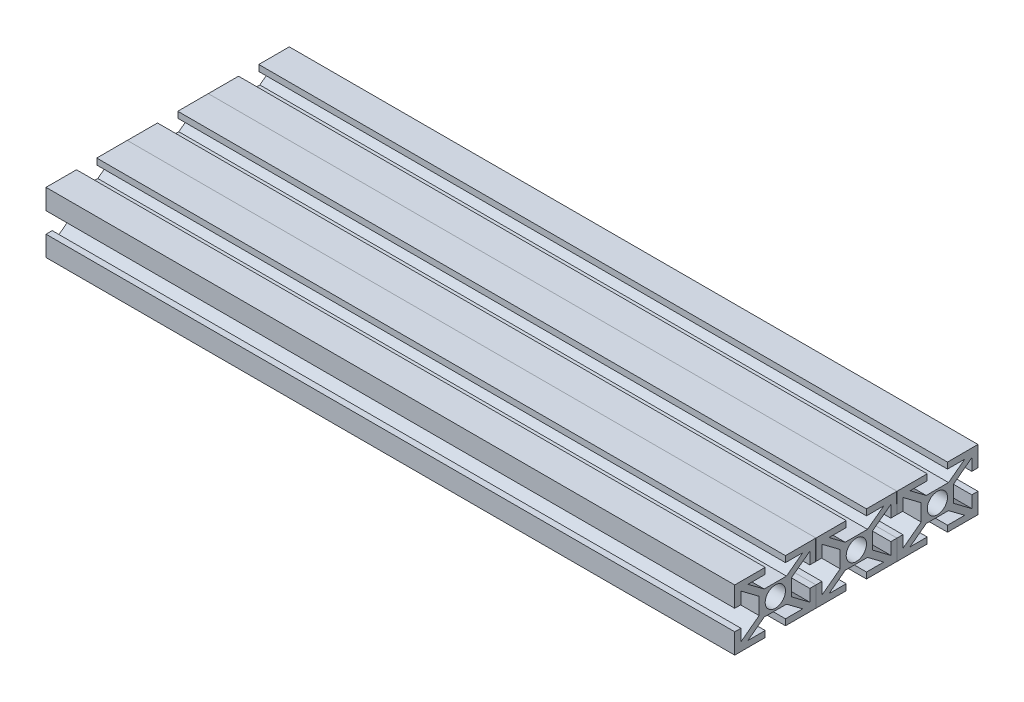
from build123d import *

# Parameters (mm, degrees)
SKETCH1_R           = 5
BOSS_EXTRUDE1_DEPTH = 340


with BuildPart() as part:
    # Sketch1 → Boss-Extrude1 (new body)
    # profile 1 of 3: a face of its own
    with BuildSketch(Plane(origin=(0, 0, 0), x_dir=(0, 0, -1), z_dir=(1, 0, 0))):
        Polygon((-17.006165996, 5.009876651), (-17, 10.875), (-8, 4.125), (-8, -4.125), (-17, -10.875), (-16.999981013, -5.030824138), (-20.040912697, -5.034570514), (-20.040912697, -15.030684523), (-4.996289083, -15.012149805), (-5, -12), (-13.5, -12), (-5.5, -6), (5.5, -6), (13.5, -12), (5.014779989, -11.993830984), (5.014779989, -15.005983074), (19.959087303, -15.005983074), (19.959087303, -5.034570514), (20.047130277, -5.034462047), (20.047099988, -5.009876651), (17.006165996, -5.009876651), (17, -10.875), (8, -4.125), (8, 4.125), (17, 10.875), (16.999981013, 5.030824138), (19.952869723, 5.034462047), (19.94058498, 15.005983074), (20.040912697, 15.005983074), (20.040912697, 15.030684523), (4.996289083, 15.012149805), (5, 12), (13.5, 12), (5.5, 6), (-5.5, 6), (-13.5, 12), (-5.014779989, 11.993830984), (-5.014779989, 15.005983074), (-20.05941502, 15.005983074), (-20.047099988, 5.009876651), align=None)
        Circle(SKETCH1_R, mode=Mode.SUBTRACT)
    # profile 2 of 3: a face of its own
    with BuildSketch(Plane(origin=(0, 0, 0), x_dir=(0, 0, -1), z_dir=(1, 0, 0))):
        Polygon((34.985220011, 15.005983074), (20.040912697, 15.005983074), (20.040912697, 5.034570514), (19.952869723, 5.034462047), (19.952900012, 5.009876651), (22.993834004, 5.009876651), (23, 10.875), (32, 4.125), (32, -4.125), (23, -10.875), (23.000018987, -5.030824138), (20.047130277, -5.034462047), (20.05941502, -15.005983074), (19.959087303, -15.005983074), (19.959087303, -15.030684523), (35.003710917, -15.012149805), (35, -12), (26.5, -12), (34.5, -6), (45.5, -6), (53.5, -12), (45.014779989, -11.993830984), (45.014779989, -15.005983074), (59.959087303, -15.005983074), (59.959087303, -5.034570514), (60.047130277, -5.034462047), (60.047099988, -5.009876651), (57.006165996, -5.009876651), (57, -10.875), (48, -4.125), (48, 4.125), (57, 10.875), (56.999981013, 5.030824138), (59.952869723, 5.034462047), (59.94058498, 15.005983074), (60.040912697, 15.005983074), (60.040912697, 15.030684523), (44.996289083, 15.012149805), (45, 12), (53.5, 12), (45.5, 6), (34.5, 6), (26.5, 12), (34.985220011, 11.993830984), align=None)
        with Locations((40, 0)):
            Circle(SKETCH1_R, mode=Mode.SUBTRACT)
    # profile 3 of 3: a face of its own
    with BuildSketch(Plane(origin=(0, 0, 0), x_dir=(0, 0, -1), z_dir=(1, 0, 0))):
        Polygon((74.985220011, 15.005983074), (60.040912697, 15.005983074), (60.040912697, 5.034570514), (59.952869723, 5.034462047), (59.952900012, 5.009876651), (62.993834004, 5.009876651), (63, 10.875), (72, 4.125), (72, -4.125), (63, -10.875), (63.000018987, -5.030824138), (60.047130277, -5.034462047), (60.05941502, -15.005983074), (59.959087303, -15.005983074), (59.959087303, -15.030684523), (75.003710917, -15.012149805), (75, -12), (66.5, -12), (74.5, -6), (85.5, -6), (93.5, -12), (85.014779989, -11.993830984), (85.014779989, -15.005983074), (100.05941502, -15.005983074), (100.047099988, -5.009876651), (97.006165996, -5.009876651), (97, -10.875), (88, -4.125), (88, 4.125), (97, 10.875), (96.999981013, 5.030824138), (100.040912697, 5.034570514), (100.040912697, 15.030684523), (84.996289083, 15.012149805), (85, 12), (93.5, 12), (85.5, 6), (74.5, 6), (66.5, 12), (74.985220011, 11.993830984), align=None)
        with Locations((80, 0)):
            Circle(SKETCH1_R, mode=Mode.SUBTRACT)
    extrude(amount=BOSS_EXTRUDE1_DEPTH)


solid = part.part
